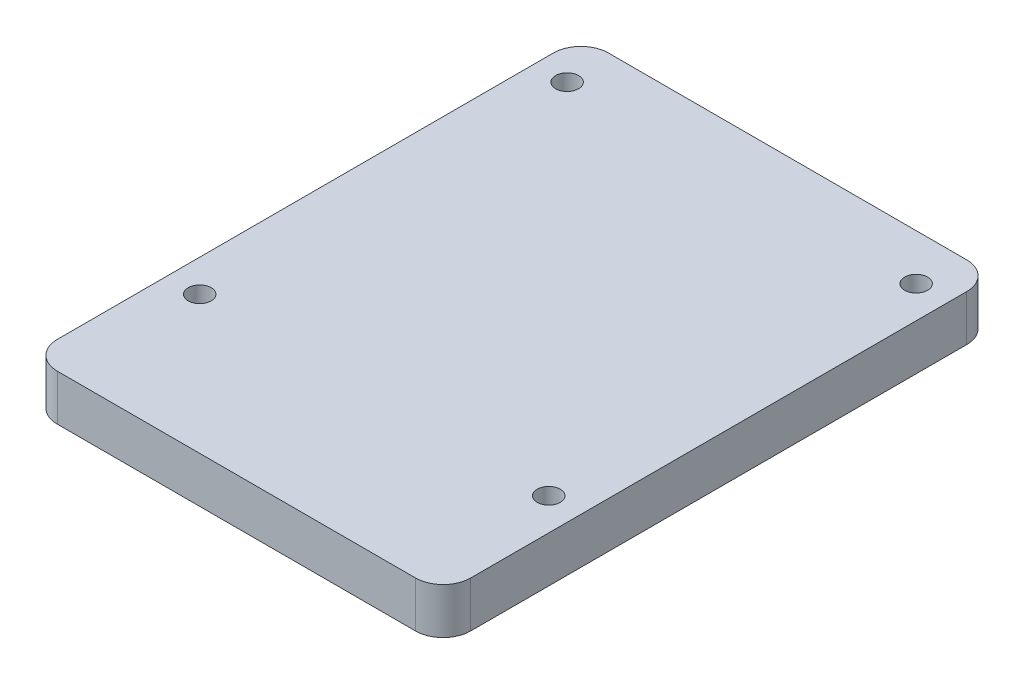
from build123d import *

# Parameters (mm, degrees)
SKETCH1_W           = 45
SKETCH1_H           = 60
SKETCH1_R           = 1.25
BOSS_EXTRUDE1_DEPTH = 5
FILLET1_R           = 3


with BuildPart() as part:
    # Sketch1 → Boss-Extrude1 (new body)
    with BuildSketch(Plane(origin=(0, 0, 0), x_dir=(1, 0, 0), z_dir=(0, 1, 0))):
        with Locations((0, -25)):
            Rectangle(SKETCH1_W, SKETCH1_H)
        with Locations(Location((-19, 0, 0), (0, 0, 270))):
            Circle(SKETCH1_R, mode=Mode.SUBTRACT)
        with Locations(Location((19, 0, 0), (0, 0, 90))):
            Circle(SKETCH1_R, mode=Mode.SUBTRACT)
        with Locations(Location((-19, -40, 0), (0, 0, 270))):
            Circle(SKETCH1_R, mode=Mode.SUBTRACT)
        with Locations(Location((19, -40, 0), (0, 0, 270))):
            Circle(SKETCH1_R, mode=Mode.SUBTRACT)
    extrude(amount=BOSS_EXTRUDE1_DEPTH)

    # Fillet1
    fillet1_edges = [part.edges().sort_by_distance(p)[0] for p in [
        (-22.5, 2.5, -5),
        (22.5, 2.5, -5),
        (22.5, 2.5, 55),
        (-22.5, 2.5, 55),
    ]]
    fillet(fillet1_edges, radius=FILLET1_R)


solid = part.part
